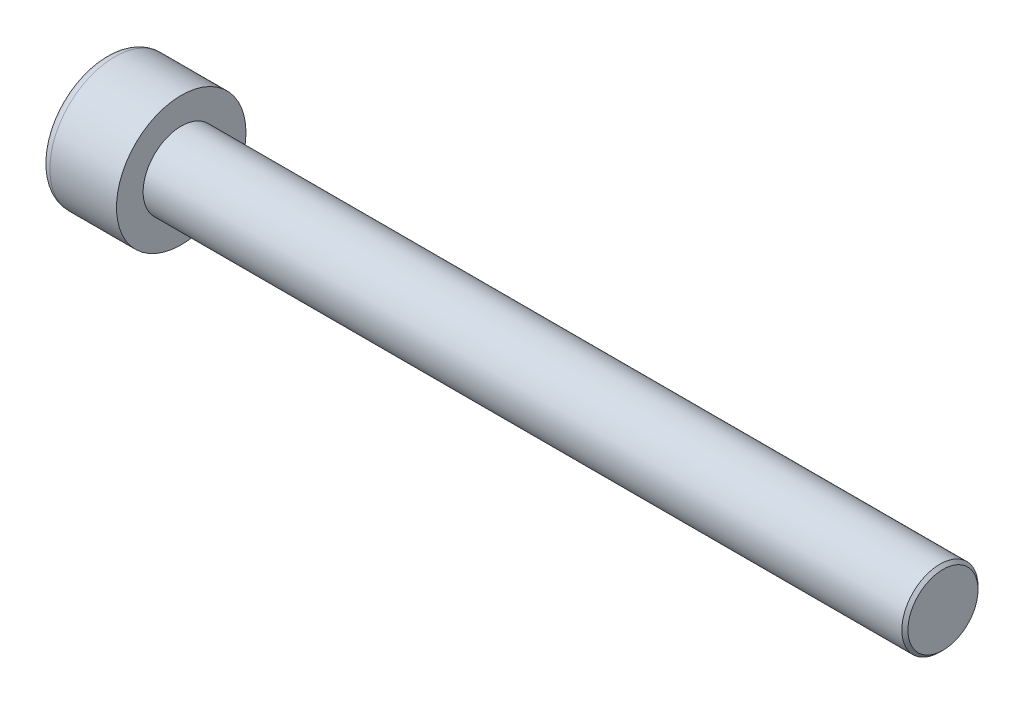
from build123d import *

# Parameters (mm, degrees)
SKETCH1_R           = 4.25
BASEHEAD_DEPTH      = 5
SKETCH2_R           = 2.5
BASEBODY_DEPTH      = 50
HEXAGONSOCKET_DEPTH = 2.5
TOPFILLET_R         = 0.625
CHAMFER1_SIZE       = 0.2


with BuildPart() as part:
    # Sketch1 → BaseHead (new body)
    with BuildSketch(Plane(origin=(0, 0, 0), x_dir=(0, 0, -1), z_dir=(1, 0, 0))):
        Circle(SKETCH1_R)
    extrude(amount=BASEHEAD_DEPTH)

    # Sketch2 → BaseBody (add)
    with BuildSketch(Plane(origin=(5, 0, 0), x_dir=(0, 0, -1), z_dir=(1, 0, 0))):
        Circle(SKETCH2_R)
    extrude(amount=BASEBODY_DEPTH)

    # Sketch3 → HexagonSocket (cut)
    with BuildSketch(Plane(origin=(0, 0, 0), x_dir=(0, 0, -1), z_dir=(1, 0, 0))):
        Polygon((2.309401077, 0), (1.154700538, 2), (-1.154700538, 2), (-2.309401077, 0), (-1.154700538, -2), (1.154700538, -2), align=None)
    extrude(amount=HEXAGONSOCKET_DEPTH, mode=Mode.SUBTRACT)

    # Sketch4 → Cut-Revolve1 (revolve, cut)
    with BuildSketch(Plane(origin=(-4.19613823, 0.75, 0), x_dir=(-1, 0, 0), z_dir=(0, 0, 1)), mode=Mode.PRIVATE) as cut_revolve1_sk:
        Polygon((-6.69613823, 2.75), (-7.850838768, 0.75), (-6.69613823, 0.75), align=None)
    revolve(cut_revolve1_sk.sketch.rotate(Axis((0.838992387, 0, 0), (-1, 0, 0)), 90), axis=Axis((0.838992387, 0, 0), (-1, 0, 0)), mode=Mode.SUBTRACT)

    # TopFillet
    topfillet_edges = [part.edges().sort_by_distance(p)[0] for p in [
        (0, 0, 4.25),
    ]]
    fillet(topfillet_edges, radius=TOPFILLET_R)

    # Chamfer1
    chamfer1_edges = [part.edges().sort_by_distance(p)[0] for p in [
        (55, 0, 2.5),
    ]]
    chamfer(chamfer1_edges, length=CHAMFER1_SIZE)


solid = part.part
